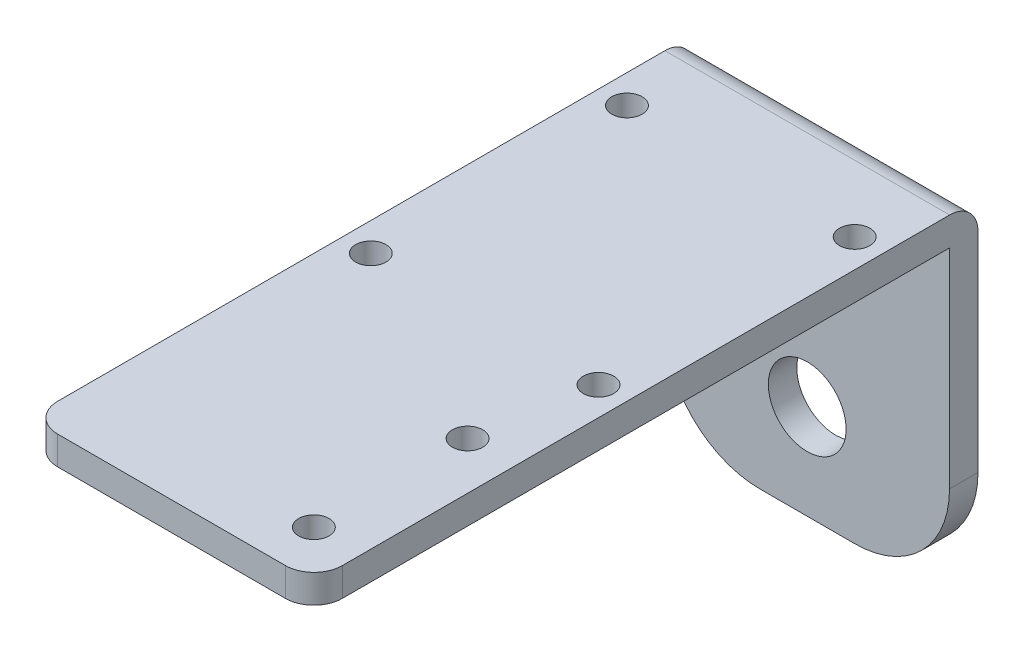
from build123d import *

# Parameters (mm, degrees)
SKETCH_1_W          = 30
SKETCH_1_H          = 70
SKETCH_1_R          = 1.6
EXTRUDE_1_DEPTH     = 3
SKETCH_2_W          = 30
SKETCH_2_H          = 3
EXTRUDE_2_DEPTH     = 32
CUT_EXTRUDE_1_REACH = 80.416
SKETCH_3_R          = 4.1
FILLET_1_R          = 3
FILLET_2_R          = 10


with BuildPart() as part:
    # 草图1 → 凸台-拉伸1 (new body)
    with BuildSketch(Plane(origin=(0, 0, 0), x_dir=(1, 0, 0), z_dir=(0, 1, 0))):
        Rectangle(SKETCH_1_W, SKETCH_1_H)
        with Locations(Location((-12, 25, 0), (0, 0, 270))):
            Circle(SKETCH_1_R, mode=Mode.SUBTRACT)
        with Locations(Location((12, 25, 0), (0, 0, 270))):
            Circle(SKETCH_1_R, mode=Mode.SUBTRACT)
        with Locations(Location((12, -2, 0), (0, 0, 270))):
            Circle(SKETCH_1_R, mode=Mode.SUBTRACT)
        with Locations(Location((-12, -2, 0), (0, 0, 270))):
            Circle(SKETCH_1_R, mode=Mode.SUBTRACT)
        with Locations(Location((10, -30, 0), (0, 0, 270))):
            Circle(SKETCH_1_R, mode=Mode.SUBTRACT)
        with Locations(Location((10, -13.8, 0), (0, 0, 270))):
            Circle(SKETCH_1_R, mode=Mode.SUBTRACT)
    extrude(amount=EXTRUDE_1_DEPTH)

    # 草图2 → 凸台-拉伸2 (add)
    with BuildSketch(Plane.XZ):
        with Locations((0, -33.5)):
            Rectangle(SKETCH_2_W, SKETCH_2_H)
    extrude(amount=EXTRUDE_2_DEPTH)

    # 草图3 → 切除-拉伸1 (cut, up to next)
    with BuildSketch(Plane(origin=(0, 0, -35), x_dir=(-1, 0, 0), z_dir=(0, 0, -1)), mode=Mode.PRIVATE) as cut_extrude_1_sk1:
        with Locations((0, -22)):
            Circle(SKETCH_3_R)
    cut_extrude_1_tool1 = extrude(cut_extrude_1_sk1.sketch, amount=-CUT_EXTRUDE_1_REACH, mode=Mode.PRIVATE) & part.part
    add(cut_extrude_1_tool1.solids().sort_by_distance((0, -22, -35))[0], mode=Mode.SUBTRACT)

    # 圆角1
    fillet_1_edges = [part.edges().sort_by_distance(p)[0] for p in [
        (15, 1.5, 35),
        (-15, 1.5, 35),
        (0, 3, -35),
    ]]
    fillet(fillet_1_edges, radius=FILLET_1_R)

    # 圆角2
    fillet_2_edges = [part.edges().sort_by_distance(p)[0] for p in [
        (15, -32, -33.5),
        (-15, -32, -33.5),
    ]]
    fillet(fillet_2_edges, radius=FILLET_2_R)


solid = part.part
